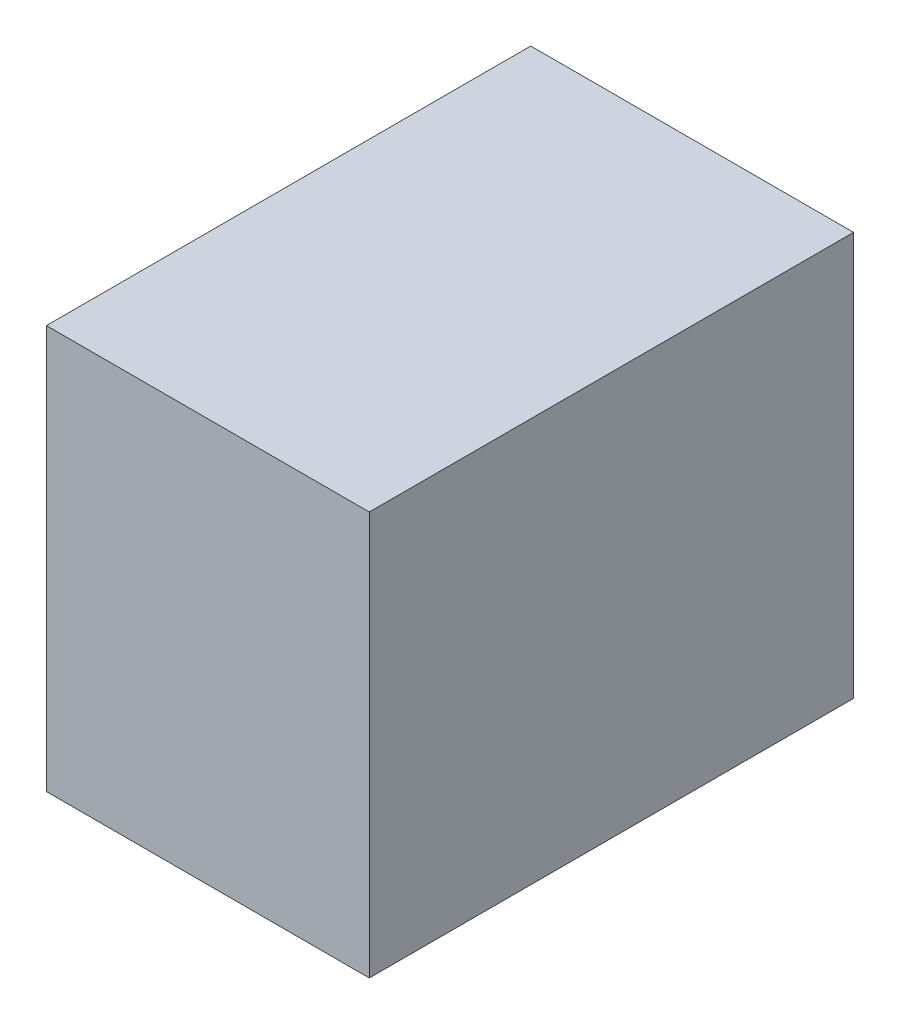
from build123d import *

# Parameters (mm, degrees)
PACK_VAKUM_SELENOID_KAPAK_1_START = -620
SKETCH1_W                         = 40
SKETCH1_H                         = 50
PACK_VAKUM_SELENOID_KAPAK_1_DEPTH = 60


with BuildPart() as part:
    # Sketch1 → PACK_vakum_selenoid_kapak_1 (new body)
    with BuildSketch(Plane.XY.offset(PACK_VAKUM_SELENOID_KAPAK_1_START)):
        with Locations((290, 345)):
            Rectangle(SKETCH1_W, SKETCH1_H)
    extrude(amount=-PACK_VAKUM_SELENOID_KAPAK_1_DEPTH)


solid = part.part
